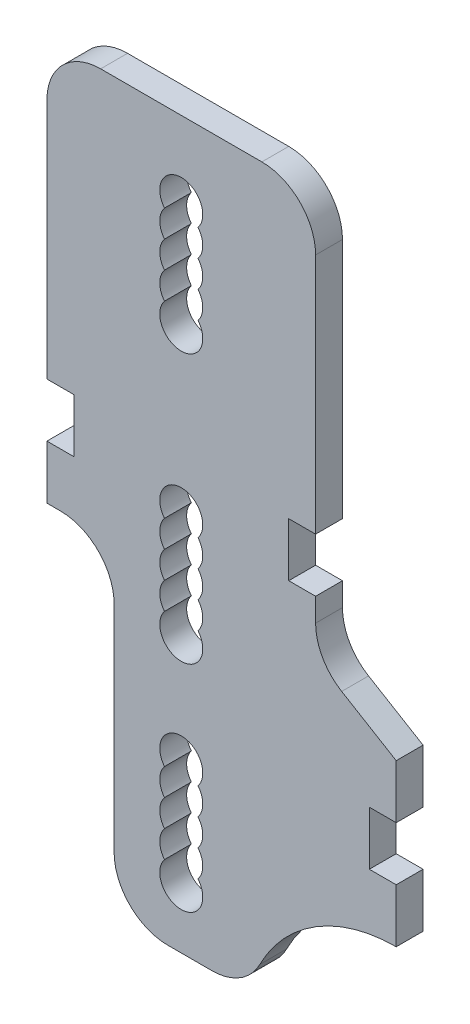
from build123d import *

# Parameters (mm, degrees)
BOSS_EXTRUDE1_DEPTH = 2.5
FILLET1_R           = 10


with BuildPart() as part:
    # Sketch1 → Boss-Extrude1 (new, symmetric)
    with BuildSketch(Plane(origin=(0, 0, 0), x_dir=(0, 1, 0), z_dir=(0, 0, 1))):
        with BuildLine():
            Line((10, 25), (0, 25))
            Line((0, 25), (0, 12.5))
            Line((0, 12.5), (-60, 12.5))
            Line((-60, 12.5), (-60, -12.5))
            ThreePointArc((-60, -12.5), (-44.850338923, -22.699349723), (-39, -40))
            Line((-39, -40), (-29, -40))
            Line((-29, -40), (-29, -35))
            Line((-29, -35), (-19, -35))
            Line((-19, -35), (-19, -40))
            Line((-19, -40), (-9, -40))
            Line((-9, -40), (0, -25))
            Line((0, -25), (10, -25))
            Line((10, -25), (10, -20))
            Line((10, -20), (20, -20))
            Line((20, -20), (20, -25))
            Line((20, -25), (75, -25))
            Line((75, -25), (75, 25))
            Line((75, 25), (20, 25))
            Line((20, 25), (20, 20))
            Line((20, 20), (10, 20))
            Line((10, 20), (10, 25))
        make_face()
        with BuildLine():
            ThreePointArc((-46.5, 3.122498999), (-44, 4), (-41.5, 3.122498999))
            ThreePointArc((-41.5, 3.122498999), (-39, 4), (-36.5, 3.122498999))
            ThreePointArc((-36.5, 3.122498999), (-34, 4), (-31.5, 3.122498999))
            ThreePointArc((-31.5, 3.122498999), (-27.267949192, 3.605551275), (-25, 0))
            ThreePointArc((-25, 0), (-27.267949192, -3.605551275), (-31.5, -3.122498999))
            ThreePointArc((-31.5, -3.122498999), (-34, -4), (-36.5, -3.122498999))
            ThreePointArc((-36.5, -3.122498999), (-39, -4), (-41.5, -3.122498999))
            ThreePointArc((-41.5, -3.122498999), (-44, -4), (-46.5, -3.122498999))
            ThreePointArc((-46.5, -3.122498999), (-53, 0), (-46.5, 3.122498999))
        make_face(mode=Mode.SUBTRACT)
        with BuildLine():
            ThreePointArc((-6.5, 3.122498999), (-4, 4), (-1.5, 3.122498999))
            ThreePointArc((-1.5, 3.122498999), (1, 4), (3.5, 3.122498999))
            ThreePointArc((3.5, 3.122498999), (6, 4), (8.5, 3.122498999))
            ThreePointArc((8.5, 3.122498999), (12.732050808, 3.605551275), (15, 0))
            ThreePointArc((15, 0), (12.732050808, -3.605551275), (8.5, -3.122498999))
            ThreePointArc((8.5, -3.122498999), (6, -4), (3.5, -3.122498999))
            ThreePointArc((3.5, -3.122498999), (1, -4), (-1.5, -3.122498999))
            ThreePointArc((-1.5, -3.122498999), (-4, -4), (-6.5, -3.122498999))
            ThreePointArc((-6.5, -3.122498999), (-13, 0), (-6.5, 3.122498999))
        make_face(mode=Mode.SUBTRACT)
        with BuildLine():
            ThreePointArc((43.5, 3.122498999), (46, 4), (48.5, 3.122498999))
            ThreePointArc((48.5, 3.122498999), (51, 4), (53.5, 3.122498999))
            ThreePointArc((53.5, 3.122498999), (56, 4), (58.5, 3.122498999))
            ThreePointArc((58.5, 3.122498999), (62.732050808, 3.605551275), (65, 0))
            ThreePointArc((65, 0), (62.732050808, -3.605551275), (58.5, -3.122498999))
            ThreePointArc((58.5, -3.122498999), (56, -4), (53.5, -3.122498999))
            ThreePointArc((53.5, -3.122498999), (51, -4), (48.5, -3.122498999))
            ThreePointArc((48.5, -3.122498999), (46, -4), (43.5, -3.122498999))
            ThreePointArc((43.5, -3.122498999), (37, 0), (43.5, 3.122498999))
        make_face(mode=Mode.SUBTRACT)
    extrude(amount=BOSS_EXTRUDE1_DEPTH, both=True)

    # Fillet1
    fillet1_edges = [part.edges().sort_by_distance(p)[0] for p in [
        (-12.5, -60, 0),
        (-12.5, 0, 0),
        (-25, 75, 0),
        (25, 75, 0),
        (25, 0, 0),
        (12.5, -60, 0),
    ]]
    fillet(fillet1_edges, radius=FILLET1_R)


solid = part.part
